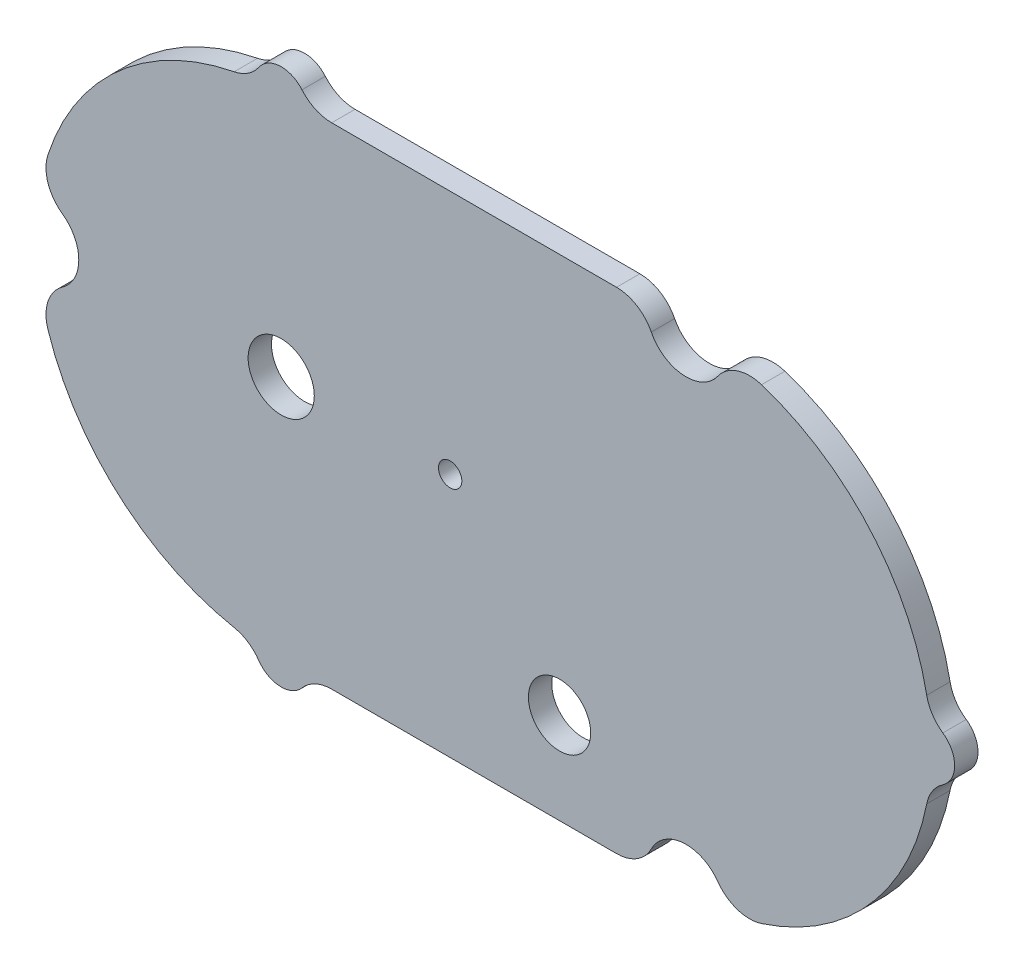
from build123d import *

# Parameters (mm, degrees)
SKETCH1_R           = 4
SKETCH1_R_2         = 4.25
SKETCH1_R_3         = 1.5
BOSS_EXTRUDE1_DEPTH = 3
FILLET1_R           = 5


with BuildPart() as part:
    # Sketch1 → Boss-Extrude1 (new body)
    with BuildSketch(Plane.XY):
        with BuildLine():
            Line((47.025062814, 31.5), (3.464101615, 31.5))
            ThreePointArc((3.464101615, 31.5), (-0.097423396, 34.498643835), (-3.486558103, 31.306451613))
            ThreePointArc((-3.486558103, 31.306451613), (-21.727681967, 22.80696903), (-31.100806452, 4.998983703))
            ThreePointArc((-31.100806452, 4.998983703), (-26, 0), (-31.100806452, -4.998983703))
            ThreePointArc((-31.100806452, -4.998983703), (-21.727681967, -22.80696903), (-3.486558103, -31.306451613))
            ThreePointArc((-3.486558103, -31.306451613), (-0.097423396, -34.498643835), (3.464101615, -31.5))
            Line((3.464101615, -31.5), (47.025062814, -31.5))
            ThreePointArc((47.025062814, -31.5), (51.800041427, -26.003999943), (56.998983703, -31.100806452))
            ThreePointArc((56.998983703, -31.100806452), (74.80696903, -21.727681967), (83.306451613, -3.486558103))
            ThreePointArc((83.306451613, -3.486558103), (86.5, 0), (83.306451613, 3.486558103))
            ThreePointArc((83.306451613, 3.486558103), (74.80696903, 21.727681967), (56.998983703, 31.100806452))
            ThreePointArc((56.998983703, 31.100806452), (51.800041427, 26.003999943), (47.025062814, 31.5))
        make_face()
        with Locations((35.75, -19.75)):
            Circle(SKETCH1_R, mode=Mode.SUBTRACT)
        Circle(SKETCH1_R_2, mode=Mode.SUBTRACT)
        with Locations((21.7, 0)):
            Circle(SKETCH1_R_3, mode=Mode.SUBTRACT)
    extrude(amount=-BOSS_EXTRUDE1_DEPTH)

    # Fillet1
    fillet1_edges = [part.edges().sort_by_distance(p)[0] for p in [
        (3.464101615, 31.5, -1.5),
        (47.025062814, 31.5, -1.5),
        (56.998983703, 31.100806452, -1.5),
        (83.306451613, 3.486558103, -1.5),
        (83.306451613, -3.486558103, -1.5),
        (56.998983703, -31.100806452, -1.5),
        (47.025062814, -31.5, -1.5),
        (3.464101615, -31.5, -1.5),
        (-3.486558103, -31.306451613, -1.5),
        (-31.100806452, -4.998983703, -1.5),
        (-31.100806452, 4.998983703, -1.5),
        (-3.486558103, 31.306451613, -1.5),
    ]]
    fillet(fillet1_edges, radius=FILLET1_R)


solid = part.part
